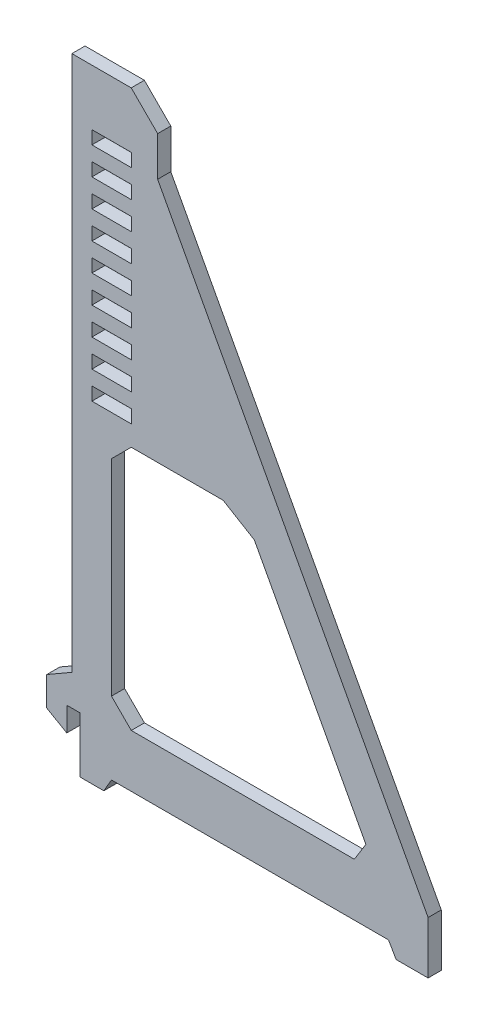
from build123d import *

# Parameters (mm, degrees)
BOSS_EXTRUDE1_DEPTH = 25.4
SCALE1_SCALE        = 25.365591398
SKETCH3_W           = 1042.369657432
SKETCH3_H           = 1273.252838884
CUT_EXTRUDE1_DEPTH  = 618.998
CHAMFER1_SIZE       = 50.8
CHAMFER2_SIZE       = 38.1
CHAMFER3_SIZE       = 40.64
CHAMFER3_SIZE2      = 40.894583593
CHAMFER4_SIZE       = 40.64
CHAMFER4_SIZE2      = 41.405123541
SKETCH4_W           = 25.4
SKETCH4_H           = 106.871356521
CUT_EXTRUDE2_DEPTH  = 618.998
SKETCH5_W           = 76.2
SKETCH5_H           = 25.4
CUT_EXTRUDE3_DEPTH  = 800.296261243
LPATTERN4_COUNT     = 2
LPATTERN4_PITCH     = 106.68
CUT_EXTRUDE4_DEPTH  = 25.4


with BuildPart() as part:
    # Sketch1 → Boss-Extrude1 (new body)
    with BuildSketch(Plane.XY):
        Polygon((-15.617276252, -25), (-13.194626522, -25), (-12.617276252, -24), (8.382723748, -24), (8.960074017, -25), (11.382723748, -25), (11.382723748, -21.02978992), (-9.117276252, 17.18), (-9.117276252, 22.18), (-15.617276252, 22.18), (-15.617276252, -18.433701616), (-17.522276252, -19.533553879), (-17.522276252, -21.733258405), (-15.617276252, -22.833110667), align=None)
        Polygon((-12.617276252, -20), (7.425731864, -20), (-2.548020957, -1.41), (-12.617276252, -1.41), align=None, mode=Mode.SUBTRACT)
    extrude(amount=BOSS_EXTRUDE1_DEPTH)


with BuildPart() as part_1:
    # Scale1: scaled about (-6.821956607, -3.861646577, 12.7)
    add(part.part.scale(SCALE1_SCALE).moved(Location((166.22100722, 94.091302618, -309.443010753))))

    # Sketch3 → Cut-Extrude1 (cut)
    with BuildSketch(Plane(origin=(0, 0, -309.443010753), x_dir=(-1, 0, 0), z_dir=(0, 0, -1))):
        with Locations((-113.67141854, 36.826872795)):
            Rectangle(SKETCH3_W, SKETCH3_H)
    extrude(amount=-CUT_EXTRUDE1_DEPTH, mode=Mode.SUBTRACT)

    # Chamfer1
    chamfer1_edges = [part_1.edges().sort_by_distance(p)[0] for p in [
        (-65.044096862, 656.700119822, 322.199),
    ]]
    chamfer(chamfer1_edges, length=CHAMFER1_SIZE)

    # Chamfer2
    chamfer2_edges = [part_1.edges().sort_by_distance(p)[0] for p in [
        (-153.823666755, -413.220525339, 322.199),
        (-153.823666755, 58.325818747, 322.199),
    ]]
    chamfer(chamfer2_edges, length=CHAMFER2_SIZE)

    # Chamfer3
    chamfer3_edges = [part_1.edges().sort_by_distance(p)[0] for p in [
        (101.588948743, 58.325818747, 322.199),
    ]]
    chamfer3_side = [part_1.faces().sort_by_distance(p)[0] for p in [
        (-7.067359006, 58.325818747, 322.199),
    ]]
    chamfer(chamfer3_edges, length=CHAMFER3_SIZE, length2=CHAMFER3_SIZE2, reference=chamfer3_side[0])

    # Chamfer4
    chamfer4_edges = [part_1.edges().sort_by_distance(p)[0] for p in [
        (354.579087503, -413.220525339, 322.199),
    ]]
    chamfer4_side = [part_1.faces().sort_by_distance(p)[0] for p in [
        (237.750829348, -195.465247251, 322.199),
    ]]
    chamfer(chamfer4_edges, length=CHAMFER4_SIZE, length2=CHAMFER4_SIZE2, reference=chamfer4_side[0])

    # Sketch4 → Cut-Extrude2 (cut)
    with BuildSketch(Plane.XY.offset(334.843010753)):
        with Locations((-227.077270504, -486.612804068)):
            Rectangle(SKETCH4_W, SKETCH4_H)
    extrude(amount=-CUT_EXTRUDE2_DEPTH, mode=Mode.SUBTRACT)

    # Sketch5 → Cut-Extrude3 (cut, through all)
    with BuildSketch(Plane.XY.offset(334.843010753)):
        with Locations((-153.322884144, 323.297517672)):
            Rectangle(SKETCH5_W, SKETCH5_H)
        with Locations((-153.322884144, 216.617517672)):
            Rectangle(SKETCH5_W, SKETCH5_H)
        with Locations((-153.322884144, 429.977517672)):
            Rectangle(SKETCH5_W, SKETCH5_H)
        with Locations((-153.322884144, 376.637517672)):
            Rectangle(SKETCH5_W, SKETCH5_H)
        with Locations((-153.322884144, 269.957517672)):
            Rectangle(SKETCH5_W, SKETCH5_H)
        with Locations((-153.322884144, 163.277517672)):
            Rectangle(SKETCH5_W, SKETCH5_H)
        with Locations((-153.322884144, 109.937517672)):
            Rectangle(SKETCH5_W, SKETCH5_H)
    cut_extrude3 = extrude(amount=-CUT_EXTRUDE3_DEPTH, mode=Mode.SUBTRACT)

    # LPattern4: Cut-Extrude3 ×2
    with Locations(*[(0, i * LPATTERN4_PITCH, 0) for i in range(1, LPATTERN4_COUNT)]):
        add(cut_extrude3, mode=Mode.SUBTRACT)

    # Sketch6 → Cut-Extrude4 (cut)
    with BuildSketch(Plane.ZY.offset(214.377270504)):
        Polygon((334.843010753, -433.177125807), (309.554989247, -411.957956289), (309.554989247, -433.177125807), align=None)
    extrude(amount=CUT_EXTRUDE4_DEPTH, mode=Mode.SUBTRACT)


solid = part_1.part
